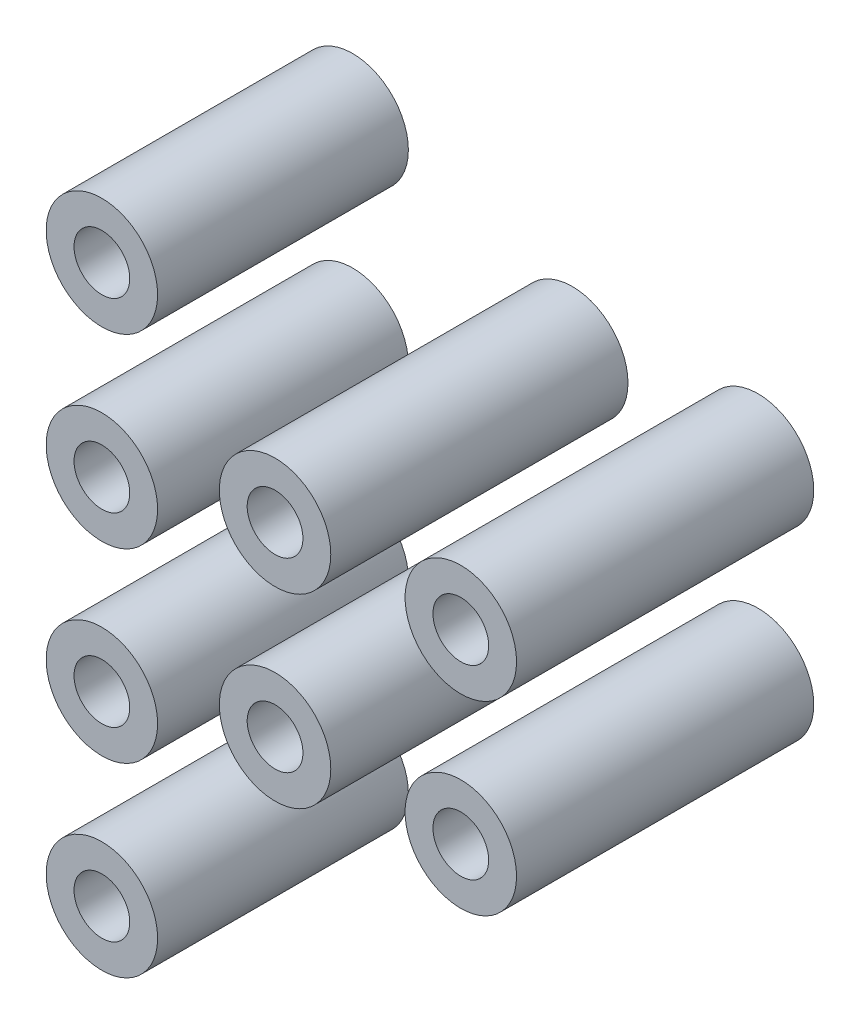
from build123d import *

# Parameters (mm, degrees)
ESQUISSE1_R                = 3
ESQUISSE1_R_2              = 1.5
BOSS_EXTRU_1_DEPTH         = 16
BOSS_EXTRU_1_2_DEPTH       = 16
BOSS_EXTRU_1_3_DEPTH       = 16
BOSS_EXTRU_1_4_DEPTH       = 16
ESQUISSE2_R                = 3
ESQUISSE2_R_2              = 1.5
BOSS_EXTRU_2_DEPTH         = 13.5
BOSS_EXTRU_2_2_DEPTH       = 13.5
R_P_TITION_LIN_AIRE1_COUNT = 2
R_P_TITION_LIN_AIRE1_PITCH = 20


with BuildPart() as part:
    # Esquisse1 → Boss.-Extru.1 (new body)
    with BuildSketch(Plane.XY):
        with Locations((10, 10)):
            Circle(ESQUISSE1_R)
        with Locations((10, 10)):
            Circle(ESQUISSE1_R_2, mode=Mode.SUBTRACT)
    extrude(amount=BOSS_EXTRU_1_DEPTH)


with BuildPart() as body_2:
    # Esquisse1 → Boss.-Extru.1 2 (new body)
    with BuildSketch(Plane.XY):
        with Locations((10, 20)):
            Circle(ESQUISSE1_R)
        with Locations((10, 20)):
            Circle(ESQUISSE1_R_2, mode=Mode.SUBTRACT)
    extrude(amount=BOSS_EXTRU_1_2_DEPTH)


with BuildPart() as body_3:
    # Esquisse1 → Boss.-Extru.1 3 (new body)
    with BuildSketch(Plane.XY):
        with Locations((0, 10)):
            Circle(ESQUISSE1_R)
        with Locations((0, 10)):
            Circle(ESQUISSE1_R_2, mode=Mode.SUBTRACT)
    extrude(amount=BOSS_EXTRU_1_3_DEPTH)


with BuildPart() as body_4:
    # Esquisse1 → Boss.-Extru.1 4 (new body)
    with BuildSketch(Plane.XY):
        with Locations((0, 20)):
            Circle(ESQUISSE1_R)
        with Locations((0, 20)):
            Circle(ESQUISSE1_R_2, mode=Mode.SUBTRACT)
    extrude(amount=BOSS_EXTRU_1_4_DEPTH)


with BuildPart() as body_5:
    # Esquisse2 → Boss.-Extru.2 (new body)
    with BuildSketch(Plane.XY):
        with Locations((-11.823031731, 14.948946981)):
            Circle(ESQUISSE2_R)
        with Locations((-11.823031731, 14.948946981)):
            Circle(ESQUISSE2_R_2, mode=Mode.SUBTRACT)
    boss_extru_2 = extrude(amount=BOSS_EXTRU_2_DEPTH)


with BuildPart() as body_6:
    # Esquisse2 → Boss.-Extru.2 2 (new body)
    with BuildSketch(Plane.XY):
        with Locations((-11.823031731, 24.948946981)):
            Circle(ESQUISSE2_R)
        with Locations((-11.823031731, 24.948946981)):
            Circle(ESQUISSE2_R_2, mode=Mode.SUBTRACT)
    boss_extru_2_2 = extrude(amount=BOSS_EXTRU_2_2_DEPTH)


with BuildPart() as r_p_tition_lin_aire1_1:
    # Répétition linéaire1: Boss.-Extru.2, Boss.-Extru.2 2 ×2
    with Locations(*[(0, -i * R_P_TITION_LIN_AIRE1_PITCH, 0) for i in range(1, R_P_TITION_LIN_AIRE1_COUNT)]):
        add(boss_extru_2)
        add(boss_extru_2_2)


solid = Compound([part.part, body_2.part, body_3.part, body_4.part, body_5.part, body_6.part, r_p_tition_lin_aire1_1.part])
